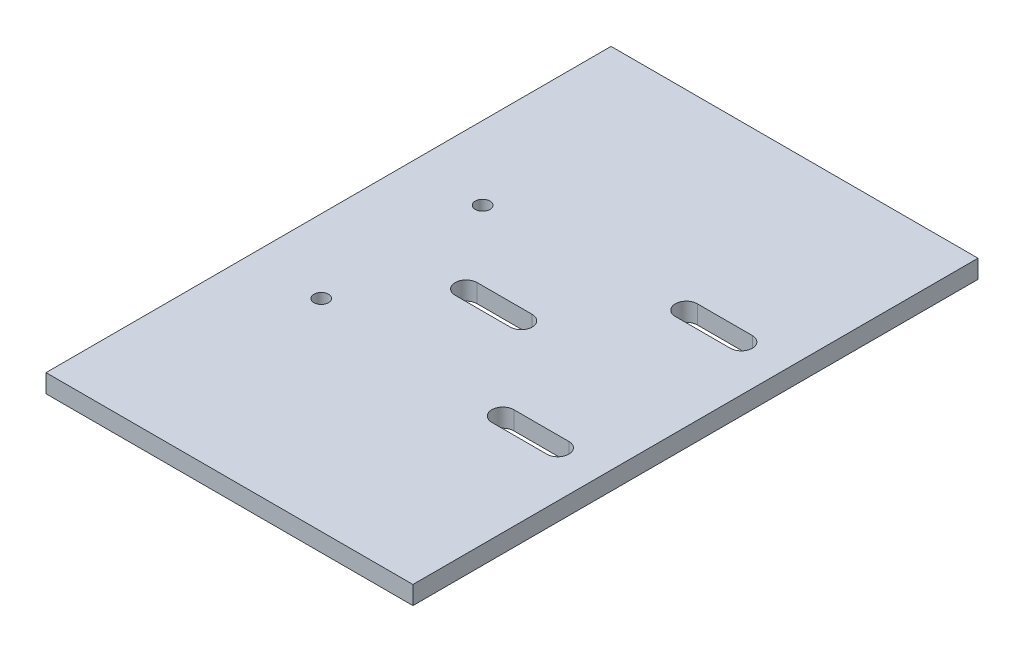
from build123d import *

# Parameters (mm, degrees)
SKETCH1_W           = 100
SKETCH1_H           = 154
SKETCH1_R           = 2
BOSS_EXTRUDE1_DEPTH = 5


with BuildPart() as part:
    # Sketch1 → Boss-Extrude1 (new body)
    with BuildSketch(Plane(origin=(0, 0, 0), x_dir=(1, 0, 0), z_dir=(0, 1, 0))):
        with Locations((23.349056604, 51.646226415)):
            Rectangle(SKETCH1_W, SKETCH1_H)
        with Locations(Location((-6.650943396, 73.646226415, 0), (0, 0, 270))):
            Circle(SKETCH1_R, mode=Mode.SUBTRACT)
        with Locations(Location((-6.650943396, 29.646226415, 0), (0, 0, 90))):
            Circle(SKETCH1_R, mode=Mode.SUBTRACT)
        with BuildLine():
            Line((45.849056604, 79.646226415), (60.849056604, 79.646226415))
            ThreePointArc((60.849056604, 79.646226415), (63.849056604, 76.646226415), (60.849056604, 73.646226415))
            Line((60.849056604, 73.646226415), (45.849056604, 73.646226415))
            ThreePointArc((45.849056604, 73.646226415), (42.849056604, 76.646226415), (45.849056604, 79.646226415))
        make_face(mode=Mode.SUBTRACT)
        with BuildLine():
            Line((10.849056604, 54.646226415), (25.849056604, 54.646226415))
            ThreePointArc((25.849056604, 54.646226415), (28.849056604, 51.646226415), (25.849056604, 48.646226415))
            Line((25.849056604, 48.646226415), (10.849056604, 48.646226415))
            ThreePointArc((10.849056604, 48.646226415), (7.849056604, 51.646226415), (10.849056604, 54.646226415))
        make_face(mode=Mode.SUBTRACT)
        with BuildLine():
            Line((45.849056604, 29.646226415), (60.849056604, 29.646226415))
            ThreePointArc((60.849056604, 29.646226415), (63.849056604, 26.646226415), (60.849056604, 23.646226415))
            Line((60.849056604, 23.646226415), (45.849056604, 23.646226415))
            ThreePointArc((45.849056604, 23.646226415), (42.849056604, 26.646226415), (45.849056604, 29.646226415))
        make_face(mode=Mode.SUBTRACT)
    extrude(amount=BOSS_EXTRUDE1_DEPTH)


solid = part.part
